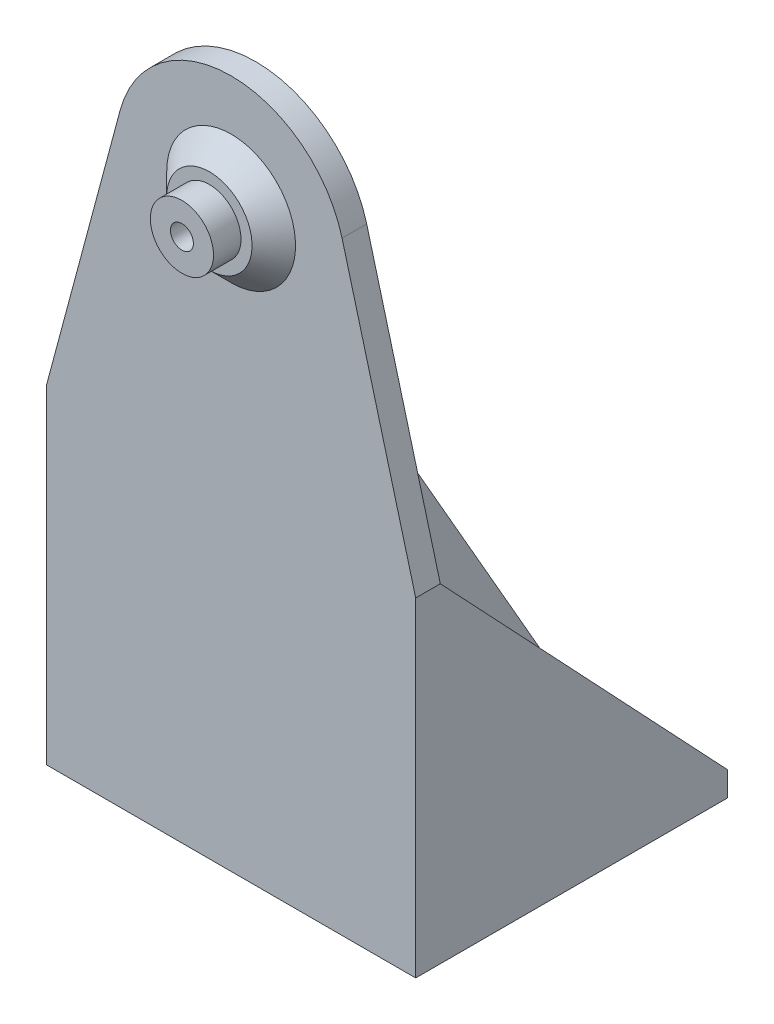
from build123d import *

# Parameters (mm, degrees)
SKETCH_1_R           = 3.85
SKETCH_1_R_2         = 1.4
EXTRUDE_1_DEPTH      = 3.35
SKETCH_3_R           = 7.85
SKETCH_2_R           = 5.2
EXTRUDE_2_DEPTH      = 3
CUT_EXTRUDE_START    = -23.35
SKETCH_7_R           = 1.4
CUT_EXTRUDE_1_DEPTH  = 23.35
SKETCH_11_W          = 44.997612104
SKETCH_11_H          = 3
EXTRUDE_3_DEPTH      = 35
CUT_EXTRUDE_4_DEPTH  = 35
EXTRUDE_4_DEPTH      = 3
EXTRUDE_5_DEPTH      = 1.5
EXTRUDE_5_DEPTH_BACK = 1.5


with BuildPart() as part:
    # 草图1 → 凸台-拉伸1 (new body)
    with BuildSketch(Plane.XY):
        Circle(SKETCH_1_R)
        Circle(SKETCH_1_R_2, mode=Mode.SUBTRACT)
    extrude(amount=-EXTRUDE_1_DEPTH)

    # 草图3 → 放样1 section 0
    with BuildSketch(Plane(origin=(0, 0, -6), x_dir=(-1, 0, 0), z_dir=(0, 0, -1))):
        Circle(SKETCH_3_R)
    # 草图2 → 放样1 section 1
    with BuildSketch(Plane(origin=(0, 0, -3.35), x_dir=(-1, 0, 0), z_dir=(0, 0, -1))):
        Circle(SKETCH_2_R)
    loft()

    # 草图6 → 凸台-拉伸2 (add)
    with BuildSketch(Plane(origin=(0, 0, -6), x_dir=(-1, 0, 0), z_dir=(0, 0, -1))):
        with BuildLine():
            Line((-22.498806052, -29.874841024), (-22.498806052, -69.994841024))
            Line((-22.498806052, -69.994841024), (22.498806052, -69.994841024))
            Line((22.498806052, -69.994841024), (22.498806052, -29.874841024))
            Line((22.498806052, -29.874841024), (13.522961568, 3.623466631))
            ThreePointArc((13.522961568, 3.623466631), (0, 14), (-13.522961568, 3.623466631))
            Line((-13.522961568, 3.623466631), (-22.498806052, -29.874841024))
        make_face()
    extrude(amount=EXTRUDE_2_DEPTH)

    # 草图7 → 切除-拉伸1 (cut)
    with BuildSketch(Plane(origin=(0, 0, -9), x_dir=(-1, 0, 0), z_dir=(0, 0, -1)).offset(CUT_EXTRUDE_START)):
        with Locations(Location((0, 0, 0), (0, 0, 180))):
            Circle(SKETCH_7_R)
    extrude(amount=CUT_EXTRUDE_1_DEPTH, mode=Mode.SUBTRACT)

    # 草图11 → 凸台-拉伸3 (add)
    with BuildSketch(Plane(origin=(0, 0, -9), x_dir=(-1, 0, 0), z_dir=(0, 0, -1))):
        with Locations((0, -68.494841024)):
            Rectangle(SKETCH_11_W, SKETCH_11_H)
    extrude(amount=EXTRUDE_3_DEPTH)

    # 草图14 → 切除-拉伸4 (cut)
    with BuildSketch(Plane(origin=(0, -66.994841024, 0), x_dir=(1, 0, 0), z_dir=(0, 1, 0))):
        with BuildLine():
            Line((14.079686052, 35), (14.079686052, 19))
            ThreePointArc((14.079686052, 19), (12.481386052, 17.4017), (10.883086052, 19))
            Line((10.883086052, 19), (10.883086052, 35))
            ThreePointArc((10.883086052, 35), (12.481386052, 36.5983), (14.079686052, 35))
        make_face()
        with BuildLine():
            ThreePointArc((-10.883086052, 19), (-12.481386052, 17.4017), (-14.079686052, 19))
            Line((-14.079686052, 19), (-14.079686052, 35))
            ThreePointArc((-14.079686052, 35), (-12.481386052, 36.5983), (-10.883086052, 35))
            Line((-10.883086052, 35), (-10.883086052, 19))
        make_face()
    extrude(amount=-CUT_EXTRUDE_4_DEPTH, mode=Mode.SUBTRACT)

    # 草图15 → 凸台-拉伸4 (add)
    with BuildSketch(Plane(origin=(22.498806052, 0, 0), x_dir=(0, 0, -1), z_dir=(1, 0, 0))):
        Polygon((9, -29.874841024), (44, -66.994841024), (44, -69.994841024), (6, -69.994841024), (6, -29.874841024), align=None)
    extrude_4 = extrude(amount=-EXTRUDE_4_DEPTH)

    # 镜向1: 凸台-拉伸4 across plane
    add(extrude_4.mirror(Plane(origin=(0, 0, 0), x_dir=(0, 0, 1), z_dir=(1, 0, 0))))

    # 草图19 → 凸台-拉伸5 (add, two sides: drawn at the far end of the back side and taken through both)
    with BuildSketch(Plane(origin=(0, 0, 0), x_dir=(0, 0, -1), z_dir=(1, 0, 0)).offset(-EXTRUDE_5_DEPTH_BACK)):
        Polygon((44, -66.994841024), (9, -6.021479283), (9, -66.994841024), align=None)
    extrude(amount=EXTRUDE_5_DEPTH + EXTRUDE_5_DEPTH_BACK)


solid = part.part
